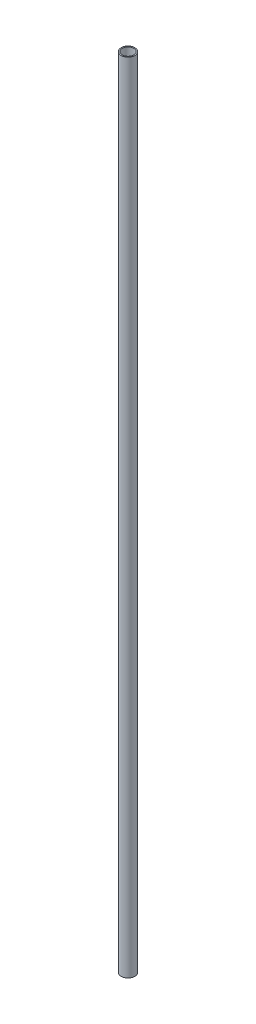
from build123d import *

# Parameters (mm, degrees)
SKETCH1_R           = 6.35
SKETCH1_R_2         = 5.35
BOSS_EXTRUDE1_DEPTH = 740


with BuildPart() as part:
    # Sketch1 → Boss-Extrude1 (new body)
    with BuildSketch(Plane(origin=(0, 0, 0), x_dir=(1, 0, 0), z_dir=(0, 1, 0))):
        with Locations(Location((0, 0, 0), (0, 0, 270))):
            Circle(SKETCH1_R)
        with Locations(Location((0, 0, 0), (0, 0, 270))):
            Circle(SKETCH1_R_2, mode=Mode.SUBTRACT)
    extrude(amount=BOSS_EXTRUDE1_DEPTH)


solid = part.part
